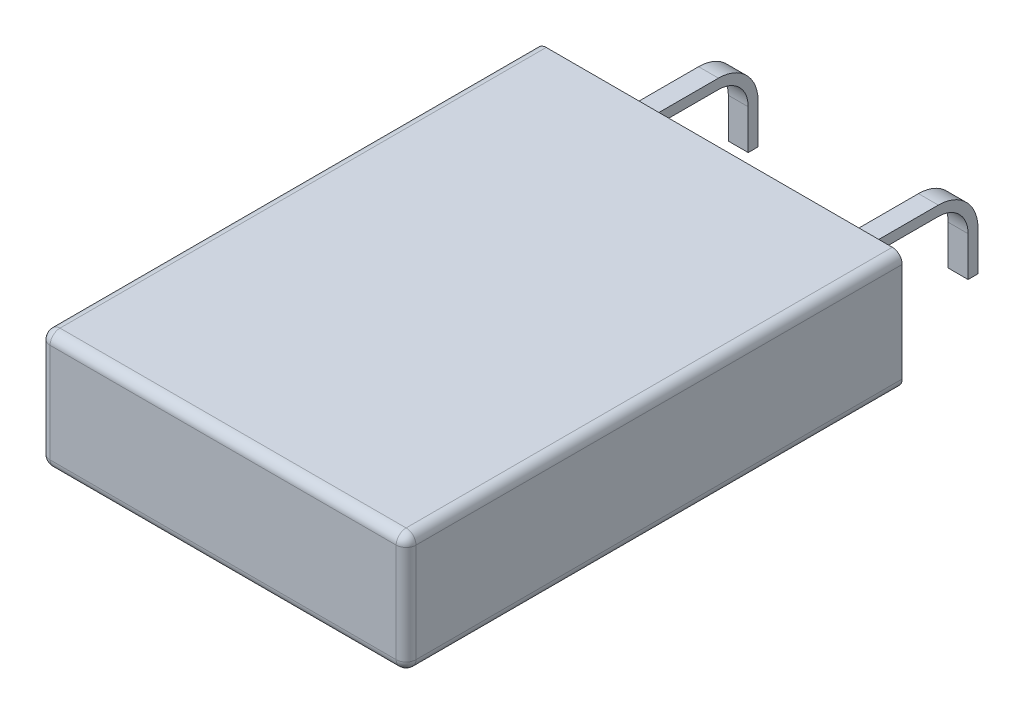
from build123d import *

# Parameters (mm, degrees)
EXTRUDE1_DEPTH     = 25
FILLET1_R          = 0.5
SKETCH3_W          = 16.44
SKETCH3_H          = 4
CUT_EXTRUDE1_DEPTH = 5
PROFILE_W          = 1
PROFILE_H          = 0.5


with BuildPart() as part:
    # Sketch2 → Extrude1 (new body)
    with BuildSketch(Plane.XY):
        with BuildLine():
            Line((0.5, 0), (17.94, 0))
            ThreePointArc((17.94, 0), (18.293553391, 0.146446609), (18.44, 0.5))
            Line((18.44, 0.5), (18.44, 5.5))
            ThreePointArc((18.44, 5.5), (18.293553391, 5.853553391), (17.94, 6))
            Line((17.94, 6), (0.5, 6))
            ThreePointArc((0.5, 6), (0.146446609, 5.853553391), (0, 5.5))
            Line((0, 5.5), (0, 0.5))
            ThreePointArc((0, 0.5), (0.146446609, 0.146446609), (0.5, 0))
        make_face()
    extrude(amount=-EXTRUDE1_DEPTH)

    # Fillet1
    fillet1_edges = [part.edges().sort_by_distance(p)[0] for p in [
        (9.22, 6, 0),
        (18.293553391, 5.853553391, 0),
        (18.44, 3, 0),
        (18.293553391, 0.146446609, 0),
        (9.22, 0, 0),
        (0.146446609, 0.146446609, 0),
        (0, 3, 0),
        (0.146446609, 5.853553391, 0),
    ]]
    fillet(fillet1_edges, radius=FILLET1_R)

    # Sketch3 → Cut-Extrude1 (cut)
    with BuildSketch(Plane(origin=(0, 0, -25), x_dir=(-1, 0, 0), z_dir=(0, 0, -1))):
        with Locations((-9.22, 3)):
            Rectangle(SKETCH3_W, SKETCH3_H)
    extrude(amount=-CUT_EXTRUDE1_DEPTH, mode=Mode.SUBTRACT)

    # Sweep1: sweep along a path in Path
    with BuildLine(Plane(origin=(9.22, 0, 0), x_dir=(0, 0, -1), z_dir=(1, 0, 0))) as sweep1_path:
        Line((20, 3.5), (30, 3.5))
        ThreePointArc((30, 3.5), (31.060660172, 3.060660172), (31.5, 2))
        Line((31.5, 2), (31.5, 0))
    # Profile → Sweep1 (sweep)
    with BuildSketch(Plane(origin=(0, 0, -20), x_dir=(-1, 0, 0), z_dir=(0, 0, -1))):
        with Locations((-14.76, 3.75)):
            Rectangle(PROFILE_W, PROFILE_H)
        with Locations((-3.68, 3.75)):
            Rectangle(PROFILE_W, PROFILE_H)
    sweep(path=sweep1_path.line)


solid = part.part
